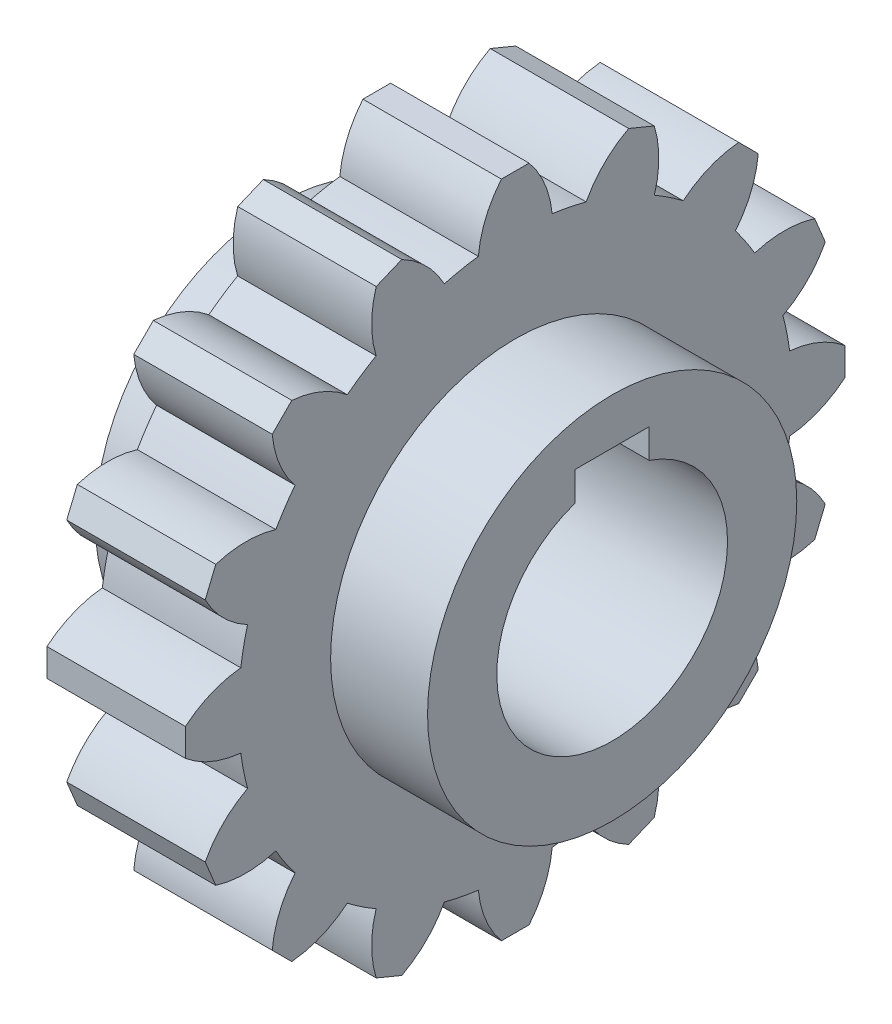
from build123d import *

# Parameters (mm, degrees)
SKETCH1_R           = 120
BOSS_EXTRUDE1_DEPTH = 30
BOSS_EXTRUDE2_DEPTH = 60
CIRPATTERN1_COUNT   = 16
SKETCH3_R           = 80
BOSS_EXTRUDE3_DEPTH = 72
CUT_EXTRUDE1_DEPTH  = 249.179654279


with BuildPart() as part:
    # Sketch1 → Boss-Extrude1 (new, symmetric)
    with BuildSketch(Plane(origin=(0, 0, 0), x_dir=(0, 0, -1), z_dir=(1, 0, 0))):
        Circle(SKETCH1_R)
    extrude(amount=BOSS_EXTRUDE1_DEPTH, both=True)

    # Sketch2 → Boss-Extrude2 (add)
    with BuildSketch(Plane(origin=(30, 0, 0), x_dir=(0, 0, -1), z_dir=(1, 0, 0))):
        with BuildLine():
            Line((-6, 142.928549979), (6, 142.928549979))
            ThreePointArc((6, 142.928549979), (12.813200818, 131.684050319), (16, 118.928549979))
            ThreePointArc((16, 118.928549979), (0, -120), (-16, 118.928549979))
            ThreePointArc((-16, 118.928549979), (-12.813200818, 131.684050319), (-6, 142.928549979))
        make_face()
    boss_extrude2 = extrude(amount=-BOSS_EXTRUDE2_DEPTH)

    # CirPattern1: Boss-Extrude2 ×16 about axis
    cirpattern1_axis = Axis((0, 0, 0), (1, 0, 0))
    for i in range(1, CIRPATTERN1_COUNT):
        add(boss_extrude2.rotate(cirpattern1_axis, i * 360 / CIRPATTERN1_COUNT))

    # Sketch3 → Boss-Extrude3 (add, symmetric)
    with BuildSketch(Plane(origin=(0, 0, 0), x_dir=(0, 0, -1), z_dir=(1, 0, 0))):
        Circle(SKETCH3_R)
    extrude(amount=BOSS_EXTRUDE3_DEPTH, both=True)

    # Sketch4 → Cut-Extrude1 (cut, through all)
    with BuildSketch(Plane(origin=(72, 0, 0), x_dir=(0, 0, -1), z_dir=(1, 0, 0))):
        with BuildLine():
            Line((-16, 60), (16, 60))
            Line((16, 60), (16, 47.370877129))
            ThreePointArc((16, 47.370877129), (0, -50), (-16, 47.370877129))
            Line((-16, 47.370877129), (-16, 60))
        make_face()
    extrude(amount=-CUT_EXTRUDE1_DEPTH, mode=Mode.SUBTRACT)


solid = part.part
